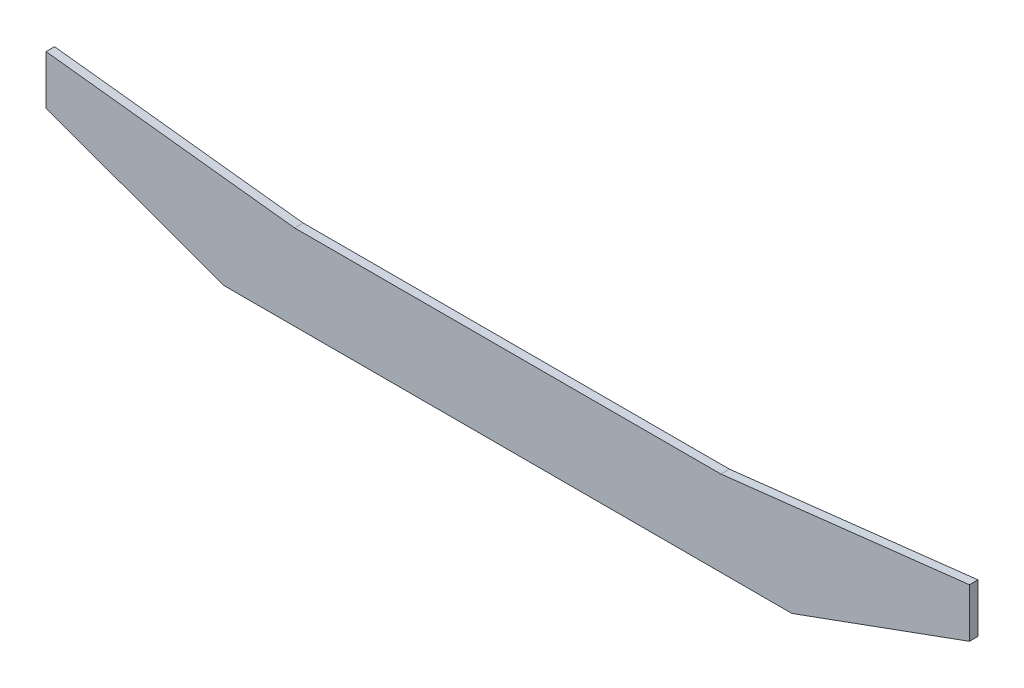
from build123d import *

# Parameters (mm, degrees)
EXTRUDE_1_DEPTH = 6


with BuildPart() as part:
    # Эскиз1 → Бобышка-Вытянуть1 (new body)
    with BuildSketch(Plane.XY):
        Polygon((-325, 80), (-325, 45.496279283), (-200, 0), (200, 0), (325, 45.496279283), (325, 80), (150, 60), (-150, 60), align=None)
    extrude(amount=EXTRUDE_1_DEPTH)


solid = part.part
